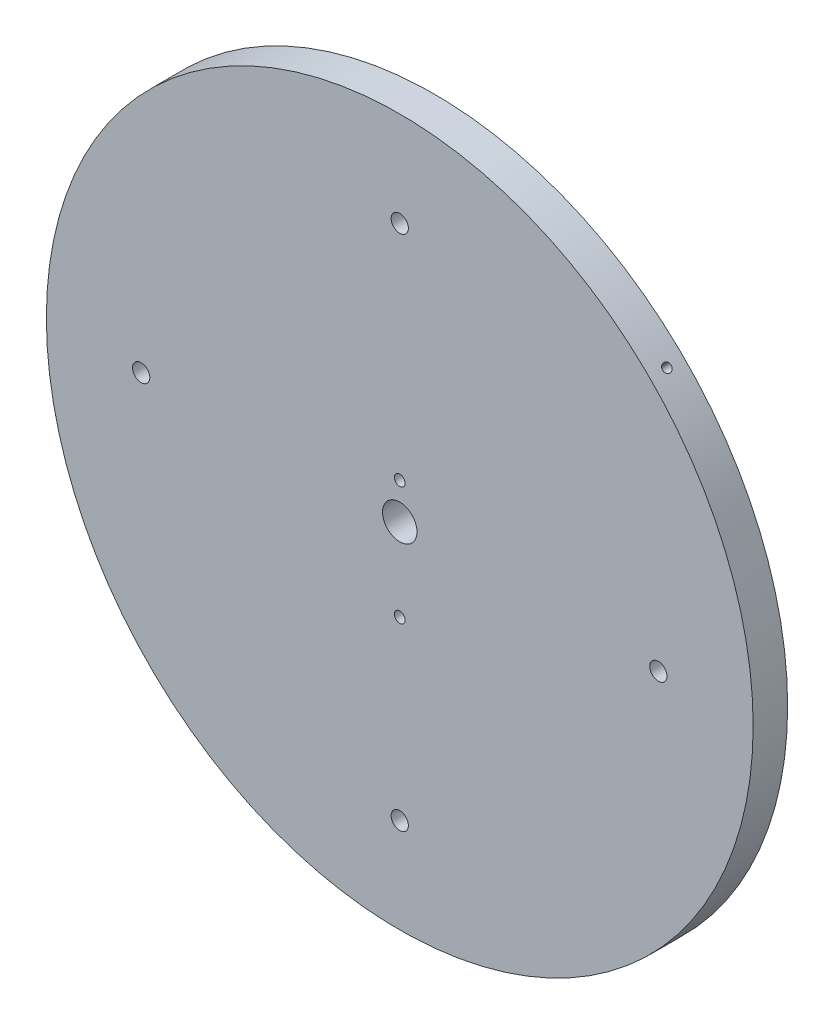
from build123d import *

# Parameters (mm, degrees)
SKETCH1_R           = 82
BOSS_EXTRUDE1_DEPTH = 8
SKETCH2_R           = 2
CUT_EXTRUDE1_DEPTH  = 8
CIRPATTERN1_COUNT   = 4
SKETCH3_R           = 4
SKETCH3_R_2         = 1.25
CUT_EXTRUDE2_DEPTH  = 10
CUT_EXTRUDE3_DEPTH  = 3.2
SKETCH5_R           = 1
CUT_EXTRUDE4_DEPTH  = 12
CIRPATTERN2_COUNT   = 4
CIRPATTERN3_COUNT   = 4


with BuildPart() as part:
    # Sketch1 → Boss-Extrude1 (new body)
    with BuildSketch(Plane.XY):
        Circle(SKETCH1_R)
    extrude(amount=BOSS_EXTRUDE1_DEPTH)

    # Sketch2 → Cut-Extrude1 (cut)
    with BuildSketch(Plane.XY.offset(8)):
        with Locations((0, 60)):
            Circle(SKETCH2_R)
    cut_extrude1 = extrude(amount=-CUT_EXTRUDE1_DEPTH, mode=Mode.SUBTRACT)

    # CirPattern1: Cut-Extrude1 ×4 about axis
    cirpattern1_axis = Axis((0, 0, 0), (0, 0, 1))
    for i in range(1, CIRPATTERN1_COUNT):
        add(cut_extrude1.rotate(cirpattern1_axis, i * 360 / CIRPATTERN1_COUNT), mode=Mode.SUBTRACT)

    # Sketch3 → Cut-Extrude2 (cut)
    with BuildSketch(Plane.XY.offset(8)):
        Circle(SKETCH3_R)
        with Locations((0, 8.38)):
            Circle(SKETCH3_R_2)
        with Locations((0, -19.13)):
            Circle(SKETCH3_R_2)
    extrude(amount=-CUT_EXTRUDE2_DEPTH, mode=Mode.SUBTRACT)

    # Sketch4 → Cut-Extrude3 (cut)
    with BuildSketch(Plane(origin=(0, 0, 0), x_dir=(-1, 0, 0), z_dir=(0, 0, -1))):
        Polygon((-162.322467781, -20.961900653), (-166.013325515, -22.608382515), (-166.432859263, -26.628000005), (-163.161535277, -29.001135634), (-159.470677543, -27.354653772), (-159.051143795, -23.335036282), align=None)
        Polygon((-64.01961749, 0.419533748), (-62.373135629, -3.271323986), (-58.353518138, -3.690857734), (-55.98038251, -0.419533748), (-57.626864371, 3.271323986), (-61.646481862, 3.690857734), align=None)
        Polygon((-183.703902182, 77.340949637), (-185.350384043, 81.031807371), (-189.370001534, 81.451341119), (-191.743137162, 78.180017133), (-190.0966553, 74.489159399), (-186.07703781, 74.069625651), align=None)
        Polygon((-85.401051891, 98.722384038), (-81.710194157, 100.3688659), (-81.290660409, 104.38848339), (-84.561984395, 106.761619019), (-88.252842129, 105.115137157), (-88.672375877, 101.095519667), align=None)
    cut_extrude3 = extrude(amount=-CUT_EXTRUDE3_DEPTH, mode=Mode.SUBTRACT)

    # Sketch5 → Cut-Extrude4 (cut)
    with BuildSketch(Plane(origin=(-57.982756057, 57.982756057, 0), x_dir=(0.7071067811865477, 0.7071067811865475, 0), z_dir=(-0.7071067811865475, 0.7071067811865477, 0))):
        with Locations(Location((0, -4, 0), (0, 0, 180))):
            Circle(SKETCH5_R)
    cut_extrude4 = extrude(amount=-CUT_EXTRUDE4_DEPTH, mode=Mode.SUBTRACT)

    # CirPattern2: Cut-Extrude4 ×4 about axis
    cirpattern2_axis = Axis((0, 0, 0), (0, 0, 1))
    for i in range(1, CIRPATTERN2_COUNT):
        add(cut_extrude4.rotate(cirpattern2_axis, i * 360 / CIRPATTERN2_COUNT), mode=Mode.SUBTRACT)

    # CirPattern3: Cut-Extrude3 ×4 about axis
    cirpattern3_axis = Axis((0, 0, 0), (0, 0, 1))
    for i in range(1, CIRPATTERN3_COUNT):
        add(cut_extrude3.rotate(cirpattern3_axis, i * 360 / CIRPATTERN3_COUNT), mode=Mode.SUBTRACT)


solid = part.part
